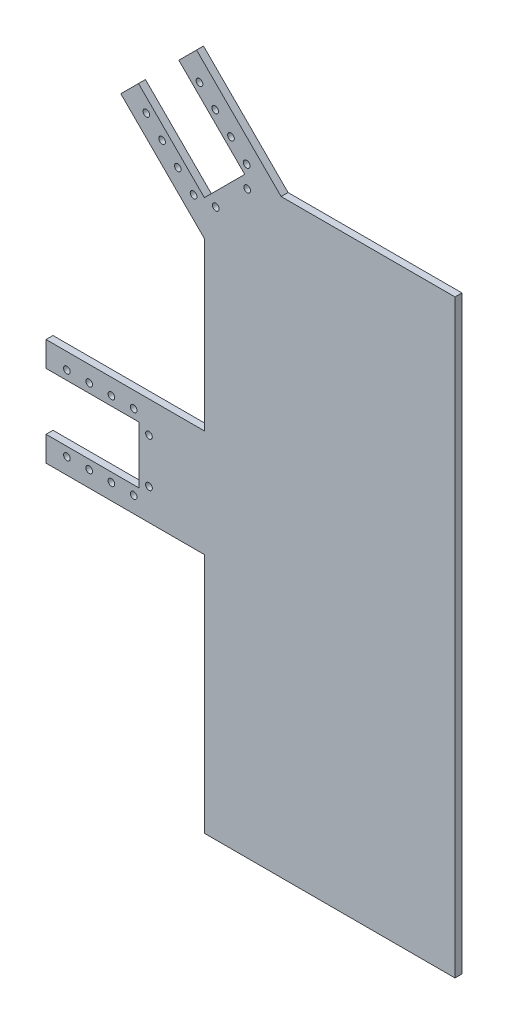
from build123d import *

# Parameters (mm, degrees)
ESQUISSE1_W             = 90
ESQUISSE1_H             = 212
BOSS_EXTRU_1_DEPTH      = 2.5
ESQUISSE2_W             = 57
ESQUISSE2_H             = 38.5
BOSS_EXTRU_2_DEPTH      = 2.5
ENL_V_MAT_EXTRU_1_REACH = 172.343
ESQUISSE3_W             = 33.5
ESQUISSE3_H             = 20.5
D_GAGEMENT_M21_D        = 2.4


with BuildPart() as part:
    # Esquisse1 → Boss.-Extru.1 (new body)
    with BuildSketch(Plane.XY):
        Rectangle(ESQUISSE1_W, ESQUISSE1_H)
    extrude(amount=BOSS_EXTRU_1_DEPTH)

    # Esquisse2 → Boss.-Extru.2 (add)
    with BuildSketch(Plane.XY.offset(2.5)):
        Polygon((-75.129202667, 109.181980515), (-45, 79.052777849), (-45, 106), (-17.5, 106), (-47.905591591, 136.405591591), align=None)
        with Locations((-73.5, 0)):
            Rectangle(ESQUISSE2_W, ESQUISSE2_H)
    extrude(amount=-BOSS_EXTRU_2_DEPTH)

    # Esquisse3 → Enlèv. mat.-Extru.1 (cut, up to next)
    with BuildSketch(Plane.XY.offset(2.5), mode=Mode.PRIVATE) as enl_v_mat_extru_1_sk1:
        Polygon((-54.269552622, 130.04163056), (-68.765241636, 115.545941546), (-45.077164466, 91.857864376), (-30.581475452, 106.353553391), align=None)
    enl_v_mat_extru_1_tool1 = extrude(enl_v_mat_extru_1_sk1.sketch, amount=-ENL_V_MAT_EXTRU_1_REACH, mode=Mode.PRIVATE) & part.part
    # Esquisse3 → Enlèv. mat.-Extru.1 (cut, up to next)
    with BuildSketch(Plane.XY.offset(2.5), mode=Mode.PRIVATE) as enl_v_mat_extru_1_sk2:
        with Locations((-85.25, 0)):
            Rectangle(ESQUISSE3_W, ESQUISSE3_H)
    enl_v_mat_extru_1_tool2 = extrude(enl_v_mat_extru_1_sk2.sketch, amount=-ENL_V_MAT_EXTRU_1_REACH, mode=Mode.PRIVATE) & part.part
    add(enl_v_mat_extru_1_tool1.solids().sort_by_distance((-49.673359, 110.949747, 2.5))[0], mode=Mode.SUBTRACT)
    add(enl_v_mat_extru_1_tool2.solids().sort_by_distance((-85.25, 0, 2.5))[0], mode=Mode.SUBTRACT)

    # Dégagement M21 (through all)
    with Locations(Plane.XY.offset(2.5)):
        with Locations((-94.5, -13.5), (-86.5, -13.5), (-78.5, -13.5), (-70.5, -13.5), (-65, -8), (-65, 8), (-70.5, 13.5), (-78.5, 13.5), (-86.5, 13.5), (-94.5, 13.5), (-41.011300474, 90.9739809), (-29.697591975, 102.287689399), (-29.874368671, 109.889087297), (-35.53122292, 115.545941546), (-41.18807717, 121.202795796), (-46.844931419, 126.859650045), (-65.936814511, 107.767766953), (-60.279960262, 102.110912703), (-54.623106012, 96.454058454), (-48.966251763, 90.797204204)):
            Hole(D_GAGEMENT_M21_D / 2)


solid = part.part
